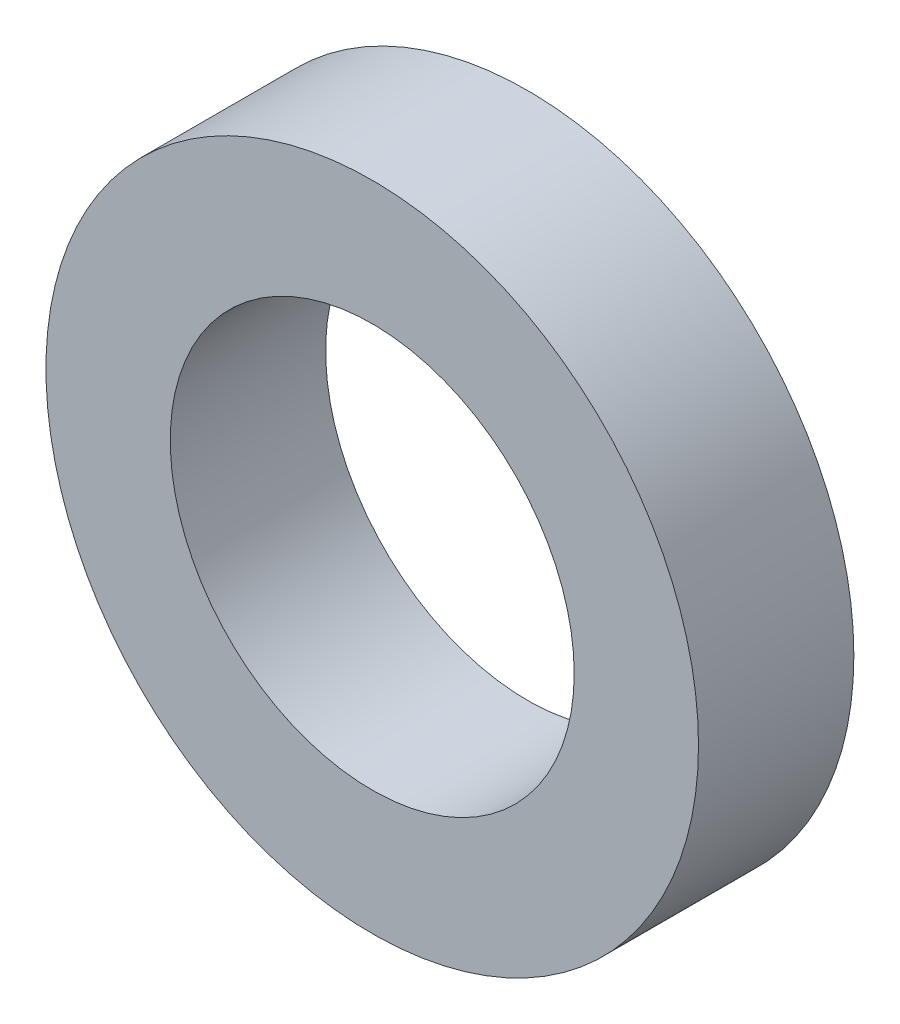
from build123d import *

# Parameters (mm, degrees)
SKETCH_2_R      = 10500
SKETCH_2_R_2    = 6500
EXTRUDE_1_DEPTH = 5000


with BuildPart() as part:
    # Эскиз2 → Бобышка-Вытянуть1 (new body)
    with BuildSketch(Plane.XY):
        Circle(SKETCH_2_R)
        Circle(SKETCH_2_R_2, mode=Mode.SUBTRACT)
    extrude(amount=EXTRUDE_1_DEPTH)


solid = part.part
